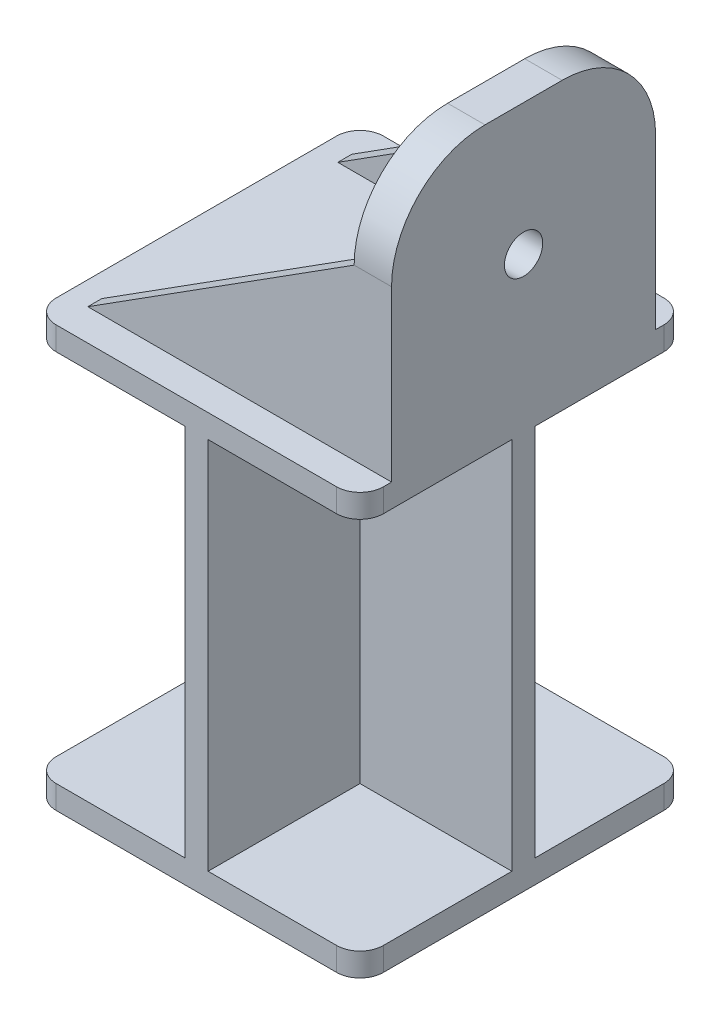
from build123d import *

# Parameters (mm, degrees)
BOSS_EXTRUDE1_DEPTH = 5
BOSS_EXTRUDE2_DEPTH = 80
SKETCH4_R           = 4.1
BOSS_EXTRUDE3_DEPTH = 8
BOSS_EXTRUDE4_DEPTH = 3


with BuildPart() as part:
    # Sketch2 → Boss-Extrude1 (new body)
    with BuildSketch(Plane(origin=(0, 0, 0), x_dir=(1, 0, 0), z_dir=(0, 1, 0))):
        with BuildLine():
            Line((-30, -35), (30, -35))
            ThreePointArc((30, -35), (33.535533906, -33.535533906), (35, -30))
            Line((35, -30), (35, 30))
            ThreePointArc((35, 30), (33.535533906, 33.535533906), (30, 35))
            Line((30, 35), (-30, 35))
            ThreePointArc((-30, 35), (-33.535533906, 33.535533906), (-35, 30))
            Line((-35, 30), (-35, -30))
            ThreePointArc((-35, -30), (-33.535533906, -33.535533906), (-30, -35))
        make_face()
    boss_extrude1 = extrude(amount=BOSS_EXTRUDE1_DEPTH)

    # Sketch3 → Boss-Extrude2 (add)
    with BuildSketch(Plane(origin=(0, 5, 0), x_dir=(1, 0, 0), z_dir=(0, 1, 0))):
        Polygon((-2.5, 2.5), (-2.5, 35), (2.5, 35), (2.5, 2.5), (35, 2.5), (35, -2.5), (2.5, -2.5), (2.5, -35), (-2.5, -35), (-2.5, -2.5), (-35, -2.5), (-35, 2.5), align=None)
    extrude(amount=BOSS_EXTRUDE2_DEPTH)

    # Mirror1: Boss-Extrude1 across plane
    add(boss_extrude1.mirror(Plane.ZX.offset(45)))

    # Sketch4 → Boss-Extrude3 (add)
    with BuildSketch(Plane(origin=(35, 0, 0), x_dir=(0, 0, -1), z_dir=(1, 0, 0))):
        with BuildLine():
            Line((-28.25, 90), (28.25, 90))
            Line((28.25, 90), (28.25, 126.2))
            ThreePointArc((28.25, 126.2), (22.392135624, 140.342135624), (8.25, 146.2))
            Line((8.25, 146.2), (-8.25, 146.2))
            ThreePointArc((-8.25, 146.2), (-22.392135624, 140.342135624), (-28.25, 126.2))
            Line((-28.25, 126.2), (-28.25, 90))
        make_face()
        with Locations((0, 118.1)):
            Circle(SKETCH4_R, mode=Mode.SUBTRACT)
    extrude(amount=-BOSS_EXTRUDE3_DEPTH)

    # Sketch5 → Boss-Extrude4 (add)
    with BuildSketch(Plane.XY.offset(28.25)):
        Polygon((35, 90), (-30, 90), (27, 126.2), (35, 126.2), align=None)
    boss_extrude4 = extrude(amount=-BOSS_EXTRUDE4_DEPTH)

    # Mirror2: Boss-Extrude4 across plane
    add(boss_extrude4.mirror(Plane(origin=(0, 0, 0), x_dir=(1, 0, 0), z_dir=(0, 0, -1))))


solid = part.part
